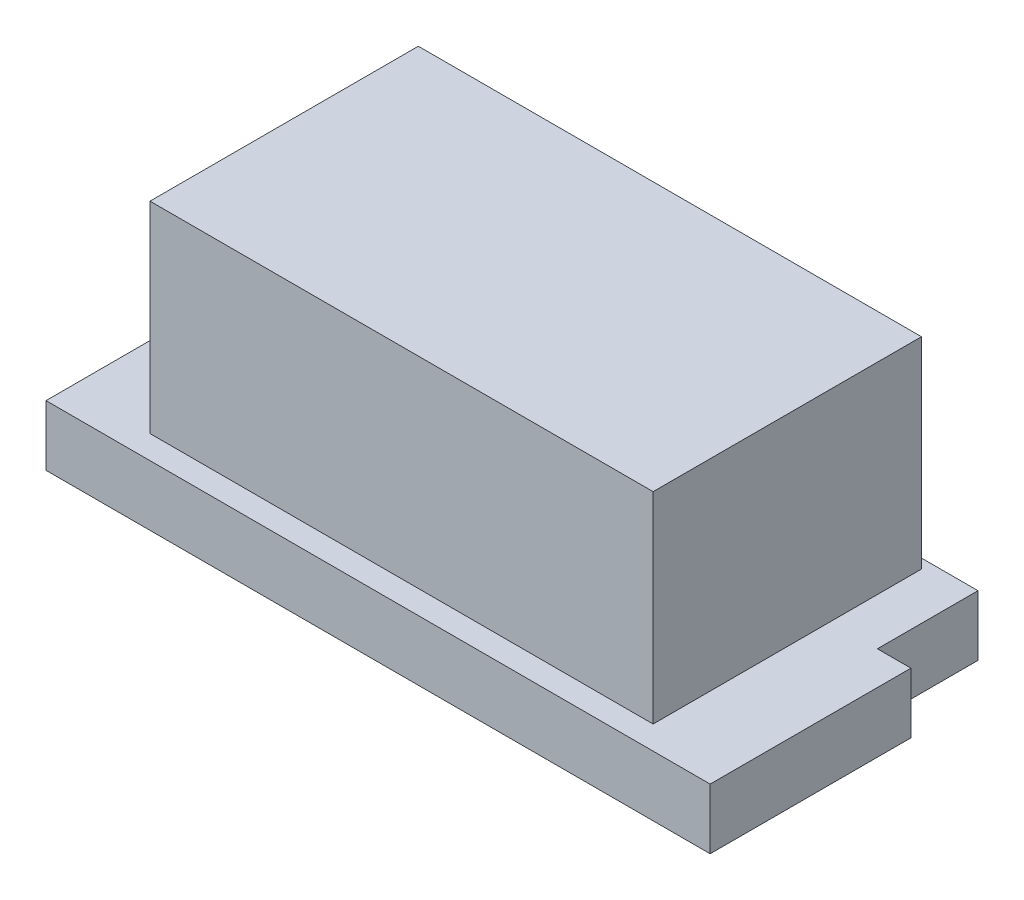
from build123d import *

# Parameters (mm, degrees)
SKETCH_1_W          = 19.8
SKETCH_1_H          = 9.8
EXTRUDE_1_DEPTH     = 1.8
SKETCH_2_W          = 15
SKETCH_2_H          = 8
EXTRUDE_2_DEPTH     = 6
SKETCH_3_W          = 1
SKETCH_3_H          = 3
CUT_EXTRUDE_1_DEPTH = 3
SKETCH_4_W          = 19.16
SKETCH_4_H          = 0.95
CUT_EXTRUDE_2_DEPTH = 3
SKETCH_7_W          = 1
SKETCH_7_H          = 3
CUT_EXTRUDE_4_DEPTH = 3


with BuildPart() as part:
    # 草图1 → 凸台-拉伸1 (new body)
    with BuildSketch(Plane(origin=(0, 0, 0), x_dir=(1, 0, 0), z_dir=(0, 1, 0))):
        with Locations((-9.9, 4.9)):
            Rectangle(SKETCH_1_W, SKETCH_1_H)
    extrude(amount=EXTRUDE_1_DEPTH)

    # 草图2 → 凸台-拉伸2 (add)
    with BuildSketch(Plane(origin=(0, 1.8, 0), x_dir=(1, 0, 0), z_dir=(0, 1, 0))):
        with Locations((-9.9, 4.7)):
            Rectangle(SKETCH_2_W, SKETCH_2_H)
    extrude(amount=EXTRUDE_2_DEPTH)

    # 草图3 → 切除-拉伸1 (cut)
    with BuildSketch(Plane(origin=(0, 1.8, 0), x_dir=(1, 0, 0), z_dir=(0, 1, 0))):
        with Locations((-19.3, 8.3)):
            Rectangle(SKETCH_3_W, SKETCH_3_H)
    extrude(amount=-CUT_EXTRUDE_1_DEPTH, mode=Mode.SUBTRACT)

    # 草图4 → 切除-拉伸2 (cut)
    with BuildSketch(Plane(origin=(0, 1.8, 0), x_dir=(1, 0, 0), z_dir=(0, 1, 0))):
        with Locations((-9.58, 9.460376994)):
            Rectangle(SKETCH_4_W, SKETCH_4_H)
    extrude(amount=-CUT_EXTRUDE_2_DEPTH, mode=Mode.SUBTRACT)

    # 草图7 → 切除-拉伸4 (cut)
    with BuildSketch(Plane(origin=(0, 1.8, 0), x_dir=(1, 0, 0), z_dir=(0, 1, 0))):
        with Locations((-0.5, 7.485376994)):
            Rectangle(SKETCH_7_W, SKETCH_7_H)
    extrude(amount=-CUT_EXTRUDE_4_DEPTH, mode=Mode.SUBTRACT)


solid = part.part
